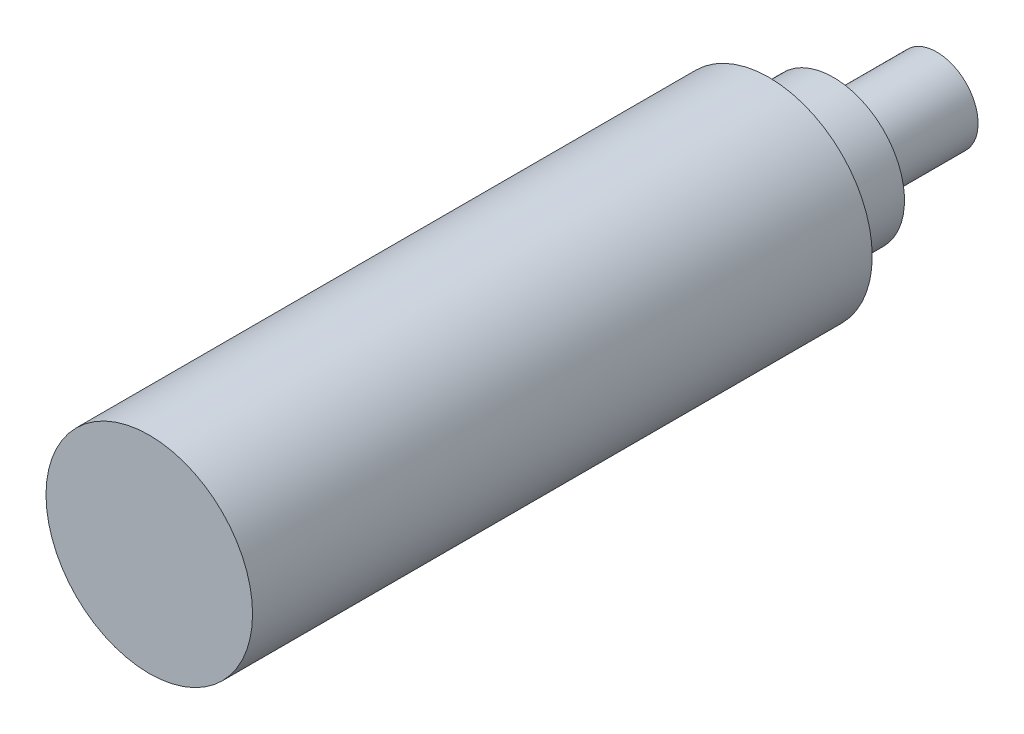
from build123d import *

# Parameters (mm, degrees)
BODYSKE_R    = 4
BODY_DEPTH   = 24
PADSKE_R     = 3
PAD_DEPTH    = 0.5
THREADSKE_R  = 2.75
THREAD_DEPTH = 2
AXISSKE_R    = 1.6
AXIS_DEPTH   = 4


with BuildPart() as part:
    # BodySke → Body (new body)
    with BuildSketch(Plane.XY):
        Circle(BODYSKE_R)
    extrude(amount=BODY_DEPTH)

    # PadSke → Pad (add)
    with BuildSketch(Plane(origin=(0, 0, 0), x_dir=(-1, 0, 0), z_dir=(0, 0, -1))):
        Circle(PADSKE_R)
    extrude(amount=PAD_DEPTH)

    # ThreadSke → Thread (add)
    with BuildSketch(Plane(origin=(0, 0, -0.5), x_dir=(-1, 0, 0), z_dir=(0, 0, -1))):
        Circle(THREADSKE_R)
    extrude(amount=THREAD_DEPTH)

    # AxisSke → Axis (add)
    with BuildSketch(Plane(origin=(0, 0, -2.5), x_dir=(-1, 0, 0), z_dir=(0, 0, -1))):
        Circle(AXISSKE_R)
    extrude(amount=AXIS_DEPTH)


solid = part.part
